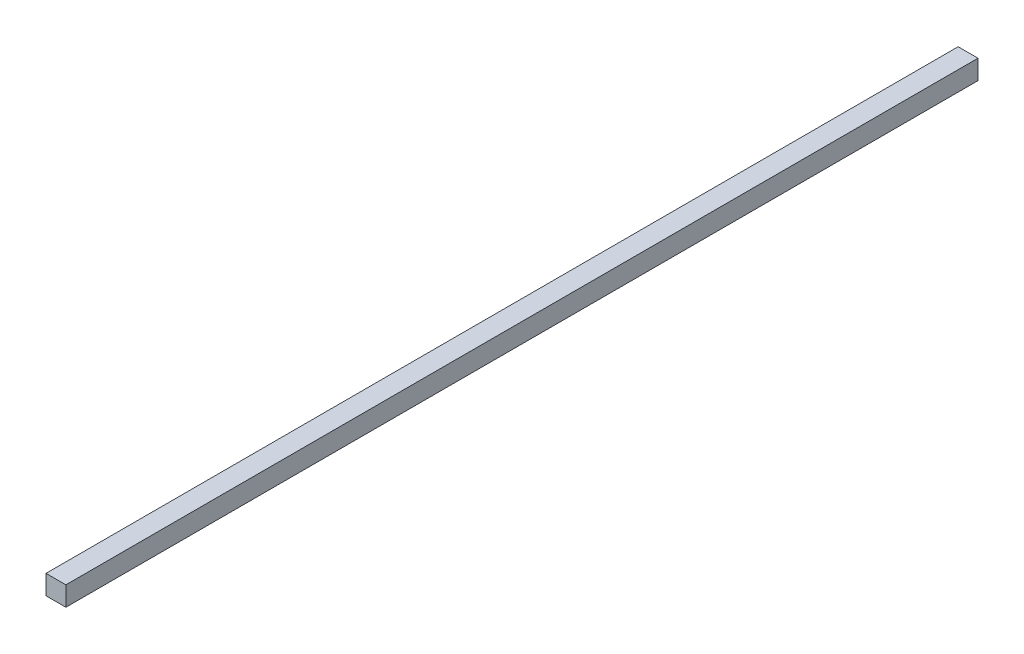
from build123d import *

# Parameters (mm, degrees)
SKETCH_1_W      = 55.348909091
SKETCH_1_H      = 54.171272727
EXTRUDE_1_DEPTH = 2540


with BuildPart() as part:
    # ｽｹｯﾁ1 → ﾎﾞｽ - 押し出し1 (new body)
    with BuildSketch(Plane.XY):
        with Locations((-24.360813831, 1.766454546)):
            Rectangle(SKETCH_1_W, SKETCH_1_H)
    extrude(amount=EXTRUDE_1_DEPTH)


solid = part.part
